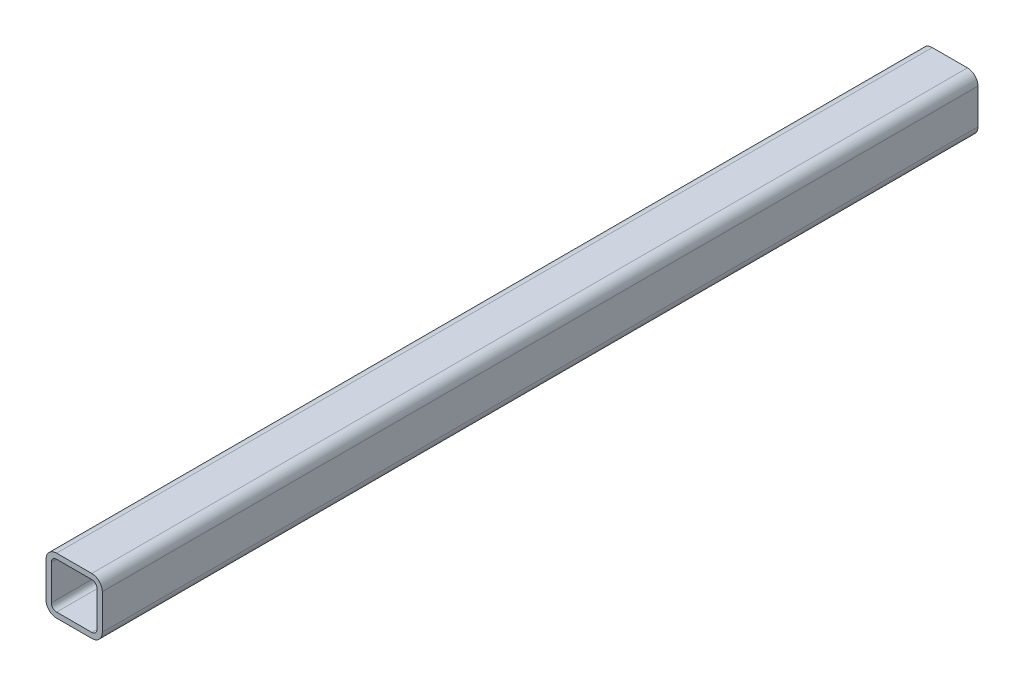
from build123d import *

# Parameters (mm, degrees)
DODANIE_WYCI_GNI_CIE1_DEPTH = 790.2


with BuildPart() as part:
    # Szkic1 → Dodanie-wyciągnięcie1 (new body)
    with BuildSketch(Plane.XY):
        with BuildLine():
            Line((9.53, 0), (41.27, 0))
            ThreePointArc((41.27, 0), (48.008727625, 2.791272375), (50.8, 9.53))
            Line((50.8, 9.53), (50.8, 41.27))
            ThreePointArc((50.8, 41.27), (48.008727625, 48.008727625), (41.27, 50.8))
            Line((41.27, 50.8), (9.53, 50.8))
            ThreePointArc((9.53, 50.8), (2.791272375, 48.008727625), (0, 41.27))
            Line((0, 41.27), (0, 9.53))
            ThreePointArc((0, 9.53), (2.791272375, 2.791272375), (9.53, 0))
        make_face()
        with BuildLine():
            Line((9.52, 46.04), (41.28, 46.04))
            ThreePointArc((41.28, 46.04), (44.645828278, 44.645828278), (46.04, 41.28))
            Line((46.04, 41.28), (46.04, 9.52))
            ThreePointArc((46.04, 9.52), (44.645828278, 6.154171722), (41.28, 4.76))
            Line((41.28, 4.76), (9.52, 4.76))
            ThreePointArc((9.52, 4.76), (6.154171722, 6.154171722), (4.76, 9.52))
            Line((4.76, 9.52), (4.76, 41.28))
            ThreePointArc((4.76, 41.28), (6.154171722, 44.645828278), (9.52, 46.04))
        make_face(mode=Mode.SUBTRACT)
    extrude(amount=DODANIE_WYCI_GNI_CIE1_DEPTH)


solid = part.part
